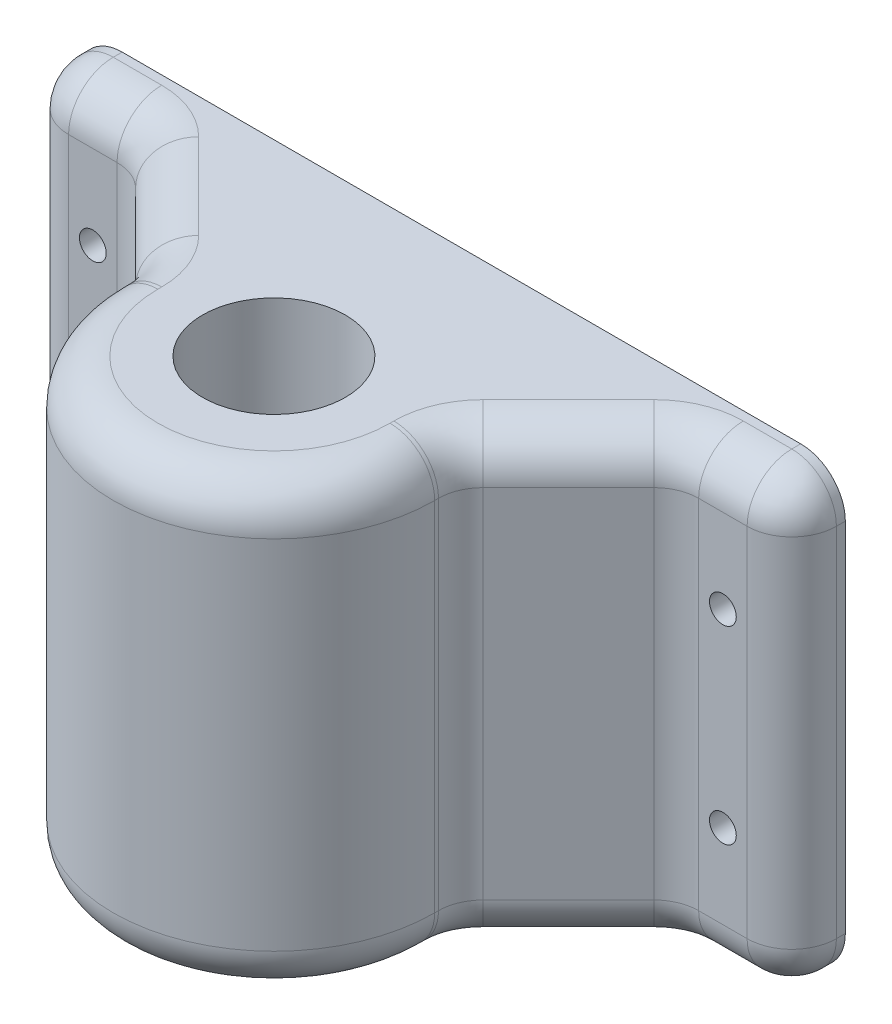
from build123d import *

# Parameters (mm, degrees)
SKETCH1_W           = 86
SKETCH1_H           = 50
BOSS_EXTRUDE2_DEPTH = 6
BOSS_EXTRUDE3_DEPTH = 50
SKETCH4_R           = 8
CUT_EXTRUDE1_DEPTH  = 121
BOSS_EXTRUDE5_DEPTH = 50
BOSS_EXTRUDE6_DEPTH = 50
FILLET1_R           = 5
FILLET2_R           = 5
FILLET3_R           = 5
FILLET4_R           = 5
FILLET5_R           = 5
SKETCH7_R           = 1.5
CUT_EXTRUDE2_DEPTH  = 50
SKETCH8_R           = 1.5
CUT_EXTRUDE4_DEPTH  = 50
SKETCH9_W           = 76
SKETCH9_H           = 50
BOSS_EXTRUDE7_DEPTH = 5
CUT_EXTRUDE5_DEPTH  = 121


with BuildPart() as part:
    # Sketch1 → Boss-Extrude2 (new body)
    with BuildSketch(Plane.XY):
        with Locations((43, 25)):
            Rectangle(SKETCH1_W, SKETCH1_H)
    extrude(amount=BOSS_EXTRUDE2_DEPTH)

    # Sketch2 → Boss-Extrude3 (add)
    with BuildSketch(Plane(origin=(0, 0, 0), x_dir=(-1, 0, 0), z_dir=(0, -1, 0))):
        with BuildLine():
            Line((-61, -21), (-61, -6))
            Line((-61, -6), (-25, -6))
            Line((-25, -6), (-25, -21))
            ThreePointArc((-25, -21), (-43, -39), (-61, -21))
        make_face()
    extrude(amount=-BOSS_EXTRUDE3_DEPTH)

    # Sketch4 → Cut-Extrude1 (cut)
    with BuildSketch(Plane(origin=(0, 0, 0), x_dir=(-1, 0, 0), z_dir=(0, -1, 0))):
        with Locations(Location((-43, -21, 0), (0, 0, 90))):
            Circle(SKETCH4_R)
    extrude(amount=-CUT_EXTRUDE1_DEPTH, mode=Mode.SUBTRACT)

    # Sketch5 → Boss-Extrude5 (add)
    with BuildSketch(Plane(origin=(0, 0, 0), x_dir=(-1, 0, 0), z_dir=(0, -1, 0))):
        Polygon((-61, -6), (-73.5, -6), (-61, -18.5), align=None)
    extrude(amount=-BOSS_EXTRUDE5_DEPTH)

    # Sketch6 → Boss-Extrude6 (add)
    with BuildSketch(Plane(origin=(0, 0, 0), x_dir=(-1, 0, 0), z_dir=(0, -1, 0))):
        Polygon((-25, -6), (-12.5, -6), (-25, -18.5), align=None)
    extrude(amount=-BOSS_EXTRUDE6_DEPTH)

    # Fillet1
    fillet1_edges = [part.edges().sort_by_distance(p)[0] for p in [
        (86, 25, 6),
    ]]
    fillet(fillet1_edges, radius=FILLET1_R)

    # Fillet2
    fillet2_edges = [part.edges().sort_by_distance(p)[0] for p in [
        (73.5, 25, 6),
    ]]
    fillet(fillet2_edges, radius=FILLET2_R)

    # Fillet3
    fillet3_edges = [part.edges().sort_by_distance(p)[0] for p in [
        (61, 25, 18.5),
    ]]
    fillet(fillet3_edges, radius=FILLET3_R)

    # Fillet4
    fillet4_edges = [part.edges().sort_by_distance(p)[0] for p in [
        (25, 25, 18.5),
        (0, 25, 6),
        (12.5, 25, 6),
    ]]
    fillet(fillet4_edges, radius=FILLET4_R)

    # Fillet5
    fillet5_edges = [part.edges().sort_by_distance(p)[0] for p in [
        (43, 0, 39),
        (61, 0, 20.785533906),
        (43, 50, 39),
        (61, 50, 20.785533906),
        (78.285533906, 50, 6),
        (86, 50, 0.5),
        (84.535533906, 50, 4.535533906),
        (86, 0, 0.5),
        (84.535533906, 0, 4.535533906),
        (78.285533906, 0, 6),
        (67.25, 0, 12.25),
        (67.25, 50, 12.25),
        (73.65765065, 0, 6.380602337),
        (73.65765065, 50, 6.380602337),
        (61.380602337, 0, 18.65765065),
        (61.380602337, 50, 18.65765065),
        (18.75, 0, 12.25),
        (18.75, 50, 12.25),
        (7.714466094, 50, 6),
        (7.714466094, 0, 6),
        (25, 50, 20.785533906),
        (25, 0, 20.785533906),
        (0, 0, 0.5),
        (1.464466094, 0, 4.535533906),
        (0, 50, 0.5),
        (1.464466094, 50, 4.535533906),
        (12.34234935, 0, 6.380602337),
        (12.34234935, 50, 6.380602337),
        (24.619397663, 0, 18.65765065),
        (24.619397663, 50, 18.65765065),
    ]]
    fillet(fillet5_edges, radius=FILLET5_R)

    # Sketch7 → Cut-Extrude2 (cut)
    with BuildSketch(Plane.XY.offset(6)):
        with Locations((7.714466094, 35.601677871)):
            Circle(SKETCH7_R)
        with Locations((7.714466094, 14.398322129)):
            Circle(SKETCH7_R)
    extrude(amount=-CUT_EXTRUDE2_DEPTH, mode=Mode.SUBTRACT)

    # Sketch8 → Cut-Extrude4 (cut)
    with BuildSketch(Plane.XY.offset(6)):
        with Locations((78.285533906, 35.60168)):
            Circle(SKETCH8_R)
        with Locations((78.285533906, 14.39832)):
            Circle(SKETCH8_R)
    extrude(amount=-CUT_EXTRUDE4_DEPTH, mode=Mode.SUBTRACT)

    # Sketch9 → Boss-Extrude7 (add)
    with BuildSketch(Plane(origin=(0, 0, 0), x_dir=(-1, 0, 0), z_dir=(0, 0, -1))):
        with Locations((-43, 25)):
            Rectangle(SKETCH9_W, SKETCH9_H)
    extrude(amount=BOSS_EXTRUDE7_DEPTH)

    # Sketch11 → Cut-Extrude5 (cut)
    with BuildSketch(Plane.ZY.offset(-5)):
        Polygon((0, 50), (-2.260657521, -1.777569844), (-5.022686567, -1.777569844), (-5, 50), align=None)
    extrude(amount=-CUT_EXTRUDE5_DEPTH, mode=Mode.SUBTRACT)


solid = part.part
